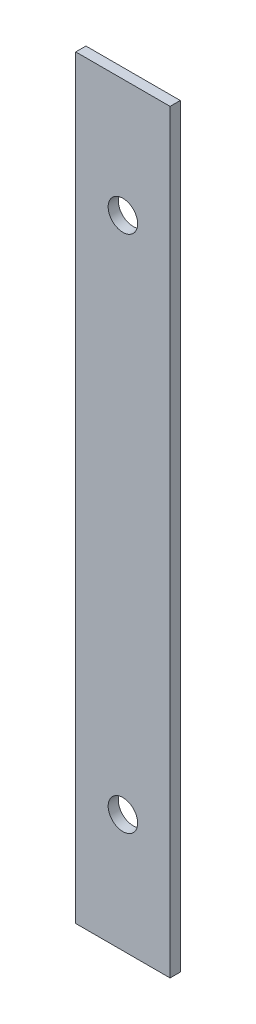
from build123d import *

# Parameters (mm, degrees)
SKETCH1_W               = 25.4
SKETCH1_H               = 2.7432
BOSS_EXTRUDE1_DEPTH     = 203.2
CUT_EXTRUDE1_DEPTH      = 109.054860552
CUT_EXTRUDE1_DEPTH_BACK = 109.054860552
SKETCH2_R               = 3.96875


with BuildPart() as part:
    # Sketch1 → Boss-Extrude1 (new body)
    with BuildSketch(Plane(origin=(0, 0, 0), x_dir=(1, 0, 0), z_dir=(0, 1, 0))):
        with Locations((12.7, -1.3716)):
            Rectangle(SKETCH1_W, SKETCH1_H)
    extrude(amount=BOSS_EXTRUDE1_DEPTH)

    # Sketch2 → Cut-Extrude1 (cut, two sides: drawn at the far end of the back side and taken through both)
    with BuildSketch(Plane(origin=(8.791703067, 106.606717755, 5.9182), x_dir=(1, 0, 0), z_dir=(0, 0, 1)).offset(-CUT_EXTRUDE1_DEPTH_BACK)):
        with Locations((3.908296933, 64.843282245)):
            Circle(SKETCH2_R)
        with Locations(Location((3.908296933, -74.856717755, 0), (0, 0, 180))):
            Circle(SKETCH2_R)
    extrude(amount=CUT_EXTRUDE1_DEPTH + CUT_EXTRUDE1_DEPTH_BACK, mode=Mode.SUBTRACT)


solid = part.part
